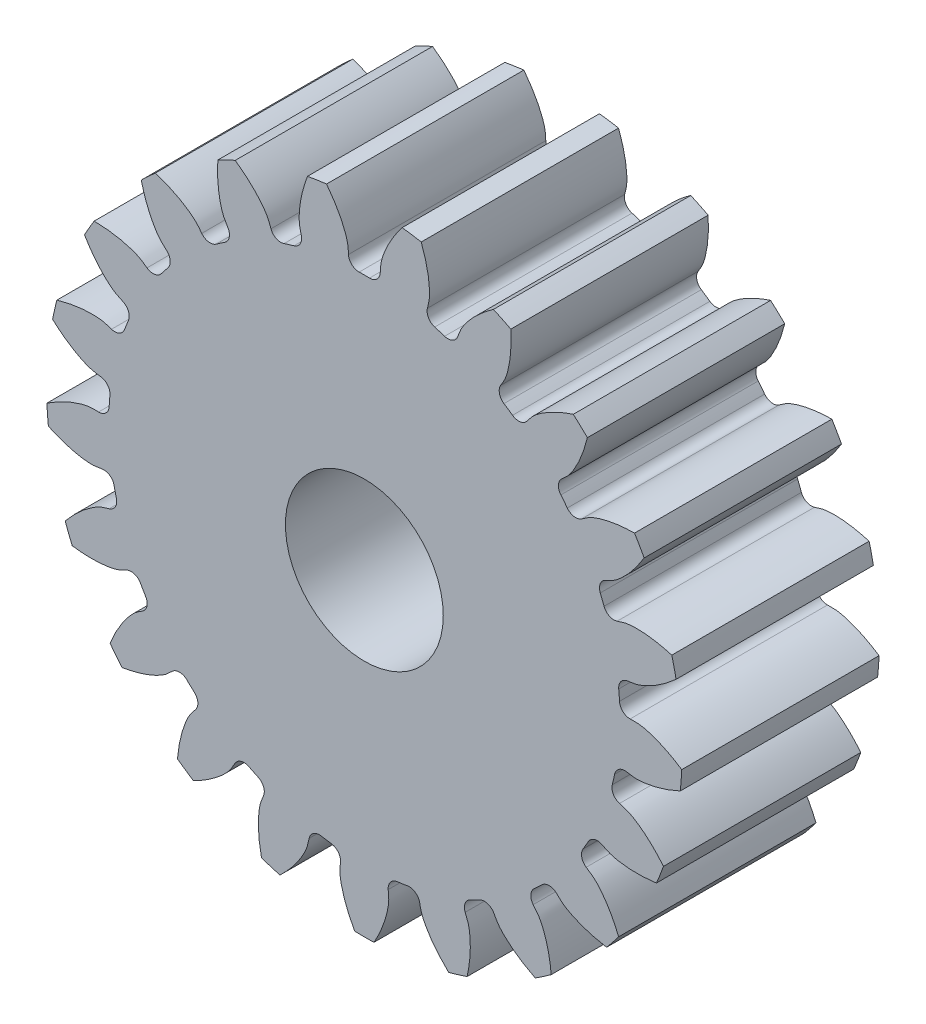
from build123d import *

# Parameters (mm, degrees)
SKETCH_1_R          = 8.05
LASHENA_DEPTH       = 5
CUT_EXTRUDEA_DEPTH  = 5
WWW_KYTOOL_CN_COUNT = 21
SKETCH_3_R          = 2
CUT_EXTRUDE_2_DEPTH = 13.428890071


with BuildPart() as part:
    # 草图1 → LaShenA (new body)
    with BuildSketch(Plane.XY):
        Circle(SKETCH_1_R)
    extrude(amount=LASHENA_DEPTH)

    # SketchA → Cut-ExtrudeA (cut)
    with BuildSketch(Plane.XY.offset(5)):
        with BuildLine():
            ThreePointArc((0.131382366, 6.473666942), (0, 6.475), (-0.131382366, 6.473666942))
            ThreePointArc((-0.131382366, 6.473666942), (-0.317156006, 6.544111829), (-0.402298836, 6.723625131))
            add(Edge.make_bspline(
                [(-0.402298836, 6.723625131), (-0.405746553, 6.780886163), (-0.408063816, 6.858592653), (-0.4206555, 6.945090397), (-0.429312397, 6.985279074), (-0.436958037, 7.017104092), (-0.446797165, 7.053566134), (-0.459044362, 7.094577869), (-0.473964631, 7.140028587), (-0.491801189, 7.189801572), (-0.512798374, 7.243768661), (-0.5371939, 7.301792182), (-0.565220794, 7.363724565), (-0.597106341, 7.429408703), (-0.633071951, 7.498678097), (-0.673332753, 7.571357071), (-0.71809728, 7.647260998), (-0.767567145, 7.726196523), (-0.821936715, 7.807961809), (-0.881392807, 7.892346786), (-0.9461144, 7.979133419), (-1.016272255, 8.068095977), (-1.119430383, 8.191881952), (-1.202281723, 8.283339287), (-1.260211149, 8.344051685)],
                knots=[0.123319169, 0.123319169, 0.123319169, 0.123319169, 0.203409424, 0.232855636, 0.245818138, 0.261137458, 0.278813596, 0.298846552, 0.321236326, 0.345982919, 0.37308633, 0.402546559, 0.434363606, 0.468537472, 0.505068156, 0.543955658, 0.585199978, 0.628801117, 0.674759074, 0.723073849, 0.773745443, 0.826773855, 0.882159085, 1, 1, 1, 1], degree=3))
            ThreePointArc((-1.260211149, 8.344051685), (0, 8.438680624), (1.260211149, 8.344051685))
            add(Edge.make_bspline(
                [(0.402298836, 6.723625131), (0.405746553, 6.780886163), (0.408063816, 6.858592653), (0.4206555, 6.945090397), (0.429312397, 6.985279074), (0.436958037, 7.017104092), (0.446797165, 7.053566134), (0.459044362, 7.094577869), (0.473964631, 7.140028587), (0.491801189, 7.189801572), (0.512798374, 7.243768661), (0.5371939, 7.301792182), (0.565220794, 7.363724565), (0.597106341, 7.429408703), (0.633071951, 7.498678097), (0.673332753, 7.571357071), (0.71809728, 7.647260998), (0.767567145, 7.726196523), (0.821936715, 7.807961809), (0.881392807, 7.892346786), (0.9461144, 7.979133419), (1.016272255, 8.068095977), (1.119430383, 8.191881952), (1.202281723, 8.283339287), (1.260211149, 8.344051685)],
                knots=[0.123319169, 0.123319169, 0.123319169, 0.123319169, 0.203409424, 0.232855636, 0.245818138, 0.261137458, 0.278813596, 0.298846552, 0.321236326, 0.345982919, 0.37308633, 0.402546559, 0.434363606, 0.468537472, 0.505068156, 0.543955658, 0.585199978, 0.628801117, 0.674759074, 0.723073849, 0.773745443, 0.826773855, 0.882159085, 1, 1, 1, 1], degree=3))
            ThreePointArc((0.402298836, 6.723625131), (0.317156006, 6.544111829), (0.131382366, 6.473666942))
        make_face()
    cut_extrudea = extrude(amount=-CUT_EXTRUDEA_DEPTH, mode=Mode.SUBTRACT)

    # www.KYTool.cn: Cut-ExtrudeA ×21 about axis
    www_kytool_cn_axis = Axis((0, 0, -88.99), (0, 0, 1))
    for i in range(1, WWW_KYTOOL_CN_COUNT):
        add(cut_extrudea.rotate(www_kytool_cn_axis, i * 360 / WWW_KYTOOL_CN_COUNT), mode=Mode.SUBTRACT)

    # 草图3 → 切除-拉伸2 (cut, through all)
    with BuildSketch(Plane.XY.offset(5)):
        Circle(SKETCH_3_R)
    extrude(amount=-CUT_EXTRUDE_2_DEPTH, mode=Mode.SUBTRACT)


solid = part.part
